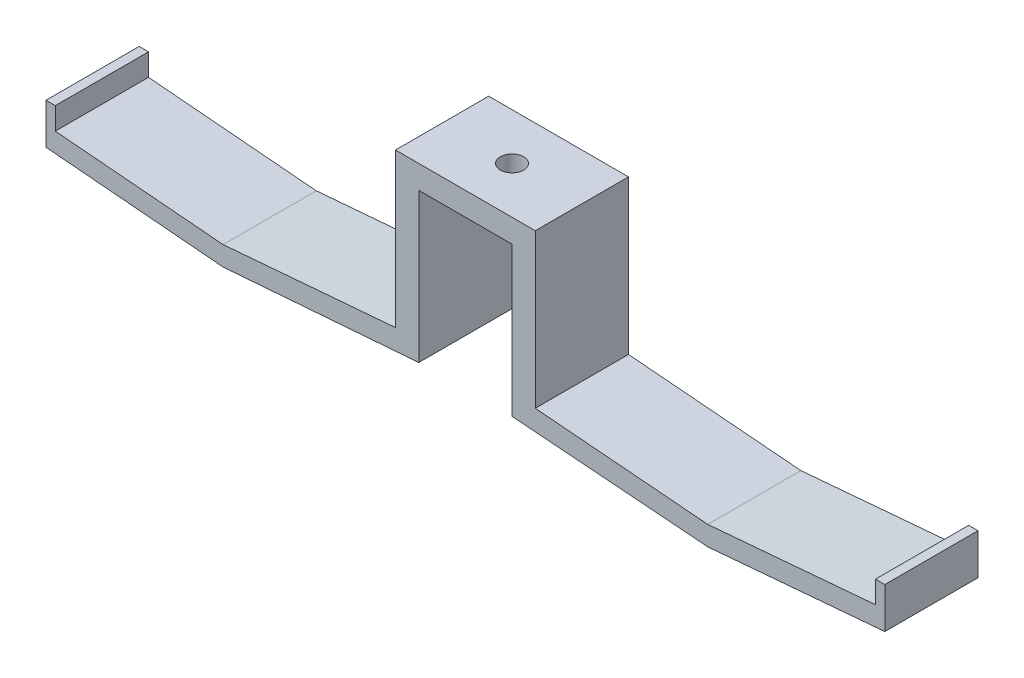
from build123d import *

# Parameters (mm, degrees)
BOSS_EXTRUDE1_DEPTH = 25.4
CUT_EXTRUDE1_REACH  = 129.762
SKETCH3_R           = 3.175


with BuildPart() as part:
    # Sketch2 → Boss-Extrude1 (new body)
    with BuildSketch(Plane.XY):
        Polygon((0, 0), (12.7, 0), (12.7, -40.64), (66.04, -44.773379719), (114.3, -40.64), (114.3, -29.533379719), (111.76, -29.533379719), (111.76, -35.56), (66.04, -39.475833418), (19.05, -35.56), (19.05, 0), (19.05, 6.35), (0, 6.35), align=None)
        Polygon((-12.7, 0), (0, 0), (0, 6.35), (-19.05, 6.35), (-19.05, 0), (-19.05, -35.56), (-66.04, -39.475833418), (-111.76, -35.56), (-111.76, -29.533379719), (-114.3, -29.533379719), (-114.3, -40.64), (-66.04, -44.773379719), (-12.7, -40.64), align=None)
    extrude(amount=BOSS_EXTRUDE1_DEPTH)

    # Sketch3 → Cut-Extrude1 (cut, up to next)
    with BuildSketch(Plane(origin=(0, 6.35, 0), x_dir=(1, 0, 0), z_dir=(0, 1, 0)), mode=Mode.PRIVATE) as cut_extrude1_sk1:
        with Locations(Location((0, -12.7, 0), (0, 0, 180))):
            Circle(SKETCH3_R)
    cut_extrude1_tool1 = extrude(cut_extrude1_sk1.sketch, amount=-CUT_EXTRUDE1_REACH, mode=Mode.PRIVATE) & part.part
    add(cut_extrude1_tool1.solids().sort_by_distance((0, 6.35, 12.7))[0], mode=Mode.SUBTRACT)


solid = part.part
